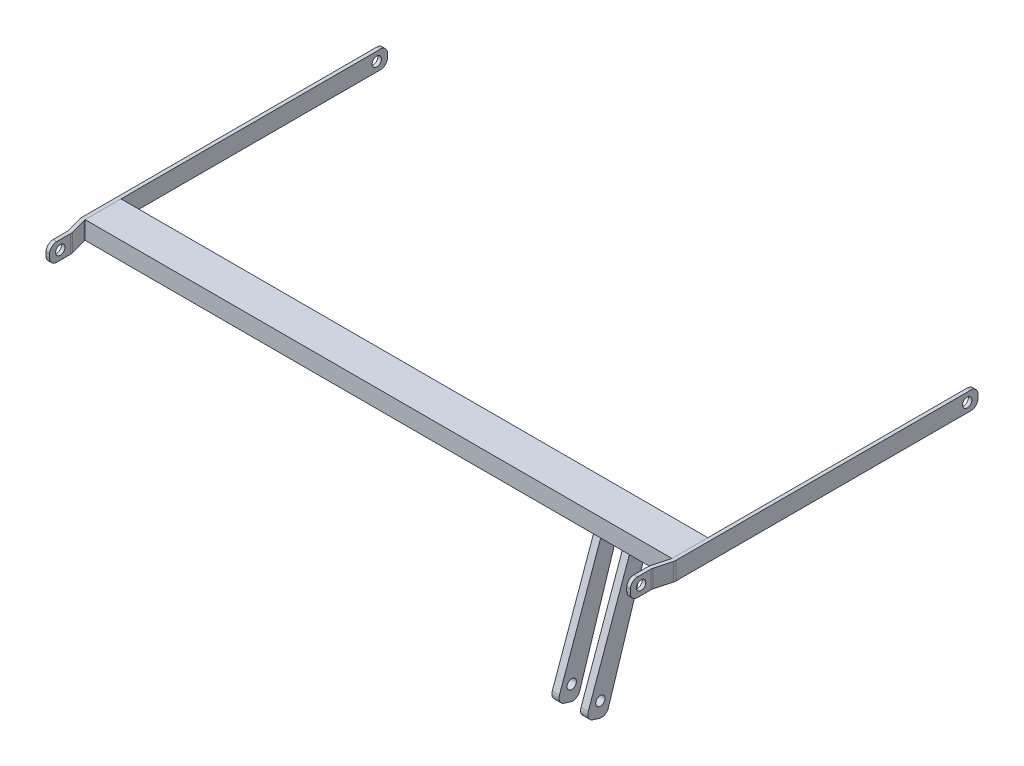
from build123d import *

# Parameters (mm, degrees)
BOSS_EXTRUDE1_DEPTH   = 12.5
BOSS_EXTRUDE1_2_DEPTH = 12.5
FILLET1_R             = 10
FILLET2_R             = 10
SKETCH2_R             = 6.5
CUT_EXTRUDE1_DEPTH    = 869
BOSS_EXTRUDE2_REACH   = 952.588
SKETCH8_W             = 50
SKETCH8_H             = 25
SKETCH9_W             = 100
SKETCH9_H             = 40
BOSS_EXTRUDE3_DEPTH   = 5
SKETCH23_R            = 6.5
BOSS_EXTRUDE4_DEPTH   = 10


with BuildPart() as part:
    # Sketch1 → Boss-Extrude1 (new, symmetric)
    with BuildSketch(Plane(origin=(0, 0, 0), x_dir=(1, 0, 0), z_dir=(0, 1, 0))):
        with BuildLine():
            Line((413.51, 0), (413.51, -420.658262488))
            ThreePointArc((413.51, -420.658262488), (413.424448614, -421.96352441), (413.169258263, -423.246452939))
            Line((413.169258263, -423.246452939), (407.084803077, -445.953948828))
            ThreePointArc((407.084803077, -445.953948828), (406.829612726, -447.236877357), (406.74406134, -448.542139279))
            Line((406.74406134, -448.542139279), (406.74406134, -477.225614303))
            Line((406.74406134, -477.225614303), (401.74406134, -477.225614303))
            Line((401.74406134, -477.225614303), (401.74406134, -447.883876791))
            ThreePointArc((401.74406134, -447.883876791), (401.829612726, -446.578614869), (402.084803077, -445.29568634))
            Line((402.084803077, -445.29568634), (408.169258263, -422.588190451))
            ThreePointArc((408.169258263, -422.588190451), (408.424448614, -421.305261922), (408.51, -420))
            Line((408.51, -420), (408.51, 0))
            Line((408.51, 0), (413.51, 0))
        make_face()
    extrude(amount=BOSS_EXTRUDE1_DEPTH, both=True)

    # Fillet2
    fillet2_edges = [part.edges().sort_by_distance(p)[0] for p in [
        (404.24406134, -12.5, 477.225614303),
        (411.01, -12.5, 0),
        (404.24406134, 12.5, 477.225614303),
        (411.01, 12.5, 0),
    ]]
    fillet(fillet2_edges, radius=FILLET2_R)


with BuildPart() as body_2:
    # Sketch1 → Boss-Extrude1 2 (new, symmetric)
    with BuildSketch(Plane(origin=(0, 0, 0), x_dir=(1, 0, 0), z_dir=(0, 1, 0))):
        with BuildLine():
            Line((-406.74406134, -477.225614303), (-401.74406134, -477.225614303))
            Line((-401.74406134, -477.225614303), (-401.74406134, -447.883876791))
            ThreePointArc((-401.74406134, -447.883876791), (-401.829612726, -446.578614869), (-402.084803077, -445.29568634))
            Line((-402.084803077, -445.29568634), (-408.169258263, -422.588190451))
            ThreePointArc((-408.169258263, -422.588190451), (-408.424448614, -421.305261922), (-408.51, -420))
            Line((-408.51, -420), (-408.51, 0))
            Line((-408.51, 0), (-413.51, 0))
            Line((-413.51, 0), (-413.51, -420.658262488))
            ThreePointArc((-413.51, -420.658262488), (-413.424448614, -421.96352441), (-413.169258263, -423.246452939))
            Line((-413.169258263, -423.246452939), (-407.084803077, -445.953948828))
            ThreePointArc((-407.084803077, -445.953948828), (-406.829612726, -447.236877357), (-406.74406134, -448.542139279))
            Line((-406.74406134, -448.542139279), (-406.74406134, -477.225614303))
        make_face()
    extrude(amount=BOSS_EXTRUDE1_2_DEPTH, both=True)

    # Fillet1
    fillet1_edges = [body_2.edges().sort_by_distance(p)[0] for p in [
        (-411.01, -12.5, 0),
        (-404.24406134, -12.5, 477.225614303),
        (-404.24406134, 12.5, 477.225614303),
        (-411.01, 12.5, 0),
    ]]
    fillet(fillet1_edges, radius=FILLET1_R)


with BuildPart() as cut_extrude1_tool:
    # Sketch2 → Cut-Extrude1 (new body)
    with BuildSketch(Plane(origin=(413.51, 0, 0), x_dir=(0, 0, -1), z_dir=(1, 0, 0))):
        with Locations((-462.225614303, 0)):
            Circle(SKETCH2_R)
        with Locations((-15, 0)):
            Circle(SKETCH2_R)
    extrude(amount=-CUT_EXTRUDE1_DEPTH)


with BuildPart() as part_1:
    add(part.part)

    # Cut-Extrude1: cut by cut_extrude1_tool
    add(cut_extrude1_tool.part, mode=Mode.SUBTRACT)


with BuildPart() as body_2_1:
    add(body_2.part)

    # Cut-Extrude1: cut by cut_extrude1_tool
    add(cut_extrude1_tool.part, mode=Mode.SUBTRACT)


with BuildPart() as body_3:

    # Sketch8 → Boss-Extrude2 (new, up to next)
    with BuildSketch(Plane.ZY.offset(-408.51), mode=Mode.PRIVATE) as boss_extrude2_sk1:
        with Locations((396.050441787, 0)):
            Rectangle(SKETCH8_W, SKETCH8_H)
    boss_extrude2_tool1 = extrude(boss_extrude2_sk1.sketch, amount=BOSS_EXTRUDE2_REACH, mode=Mode.PRIVATE) - body_2_1.part
    add(boss_extrude2_tool1.solids().sort_by_distance((408.51, 0, 396.050442))[0])


with BuildPart() as body_4:
    # Sketch9 → Boss-Extrude3 (new body)
    with BuildSketch(Plane.XZ.offset(12.5)):
        with Locations((308.51, 396.050441787)):
            Rectangle(SKETCH9_W, SKETCH9_H)
    extrude(amount=BOSS_EXTRUDE3_DEPTH)

    # Sketch23 → Boss-Extrude4 (add)
    with BuildSketch(Plane(origin=(338.51, 0, 0), x_dir=(0, 0, -1), z_dir=(1, 0, 0))):
        with BuildLine():
            Line((-410.114254625, -22.716240837), (-381.986628949, -12.283759163))
            Line((-381.986628949, -12.283759163), (-439.577352288, -193.345374602))
            ThreePointArc((-439.577352288, -193.345374602), (-444.511800202, -199.196004274), (-452.138001698, -199.843842607))
            Line((-452.138001698, -199.843842607), (-461.32796509, -196.920767841))
            ThreePointArc((-461.32796509, -196.920767841), (-467.257664146, -191.830155733), (-467.714501489, -184.028427581))
            Line((-467.714501489, -184.028427581), (-410.114254625, -22.716240837))
        make_face()
        with Locations((-450.67080199, -179.32318781)):
            Circle(SKETCH23_R, mode=Mode.SUBTRACT)
    boss_extrude4 = extrude(amount=-BOSS_EXTRUDE4_DEPTH)

    # Mirror1: Boss-Extrude4 across plane
    add(boss_extrude4.mirror(Plane(origin=(313.51, 0, 0), x_dir=(0, 0, 1), z_dir=(1, 0, 0))))


solid = Compound([part_1.part, body_2_1.part, body_3.part, body_4.part])
